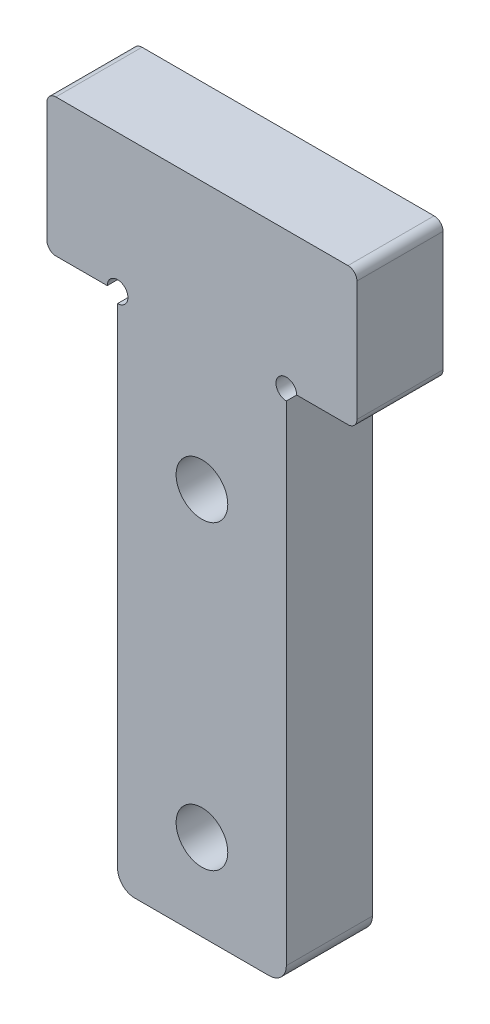
from build123d import *

# Parameters (mm, degrees)
SKETCH_1_R      = 1.5
EXTRUDE_1_DEPTH = 5


with BuildPart() as part:
    # 草图1 → 凸台-拉伸1 (new body)
    with BuildSketch(Plane.XY):
        with BuildLine():
            Line((-4.9, -4.6), (-4.9, -33))
            ThreePointArc((-4.9, -33), (-4.607106781, -33.707106781), (-3.9, -34))
            Line((-3.9, -34), (3.9, -34))
            ThreePointArc((3.9, -34), (4.607106781, -33.707106781), (4.9, -33))
            Line((4.9, -33), (4.9, -4.6))
            ThreePointArc((4.9, -4.6), (4.475735931, -3.575735931), (5.5, -4))
            Line((5.5, -4), (5.9, -4))
            Line((5.9, -4), (8.480562012, -4))
            ThreePointArc((8.480562012, -4), (8.847860136, -3.847860136), (9, -3.480562012))
            Line((9, -3.480562012), (9, 3.480562012))
            ThreePointArc((9, 3.480562012), (8.847860136, 3.847860136), (8.480562012, 4))
            Line((8.480562012, 4), (-8.480562012, 4))
            ThreePointArc((-8.480562012, 4), (-8.847860136, 3.847860136), (-9, 3.480562012))
            Line((-9, 3.480562012), (-9, -3.480562012))
            ThreePointArc((-9, -3.480562012), (-8.847860136, -3.847860136), (-8.480562012, -4))
            Line((-8.480562012, -4), (-5.9, -4))
            Line((-5.9, -4), (-5.5, -4))
            ThreePointArc((-5.5, -4), (-4.475735931, -3.575735931), (-4.9, -4.6))
        make_face()
        with Locations((0, -11.5)):
            Circle(SKETCH_1_R, mode=Mode.SUBTRACT)
        with Locations((0, -29)):
            Circle(SKETCH_1_R, mode=Mode.SUBTRACT)
    extrude(amount=EXTRUDE_1_DEPTH)


solid = part.part
